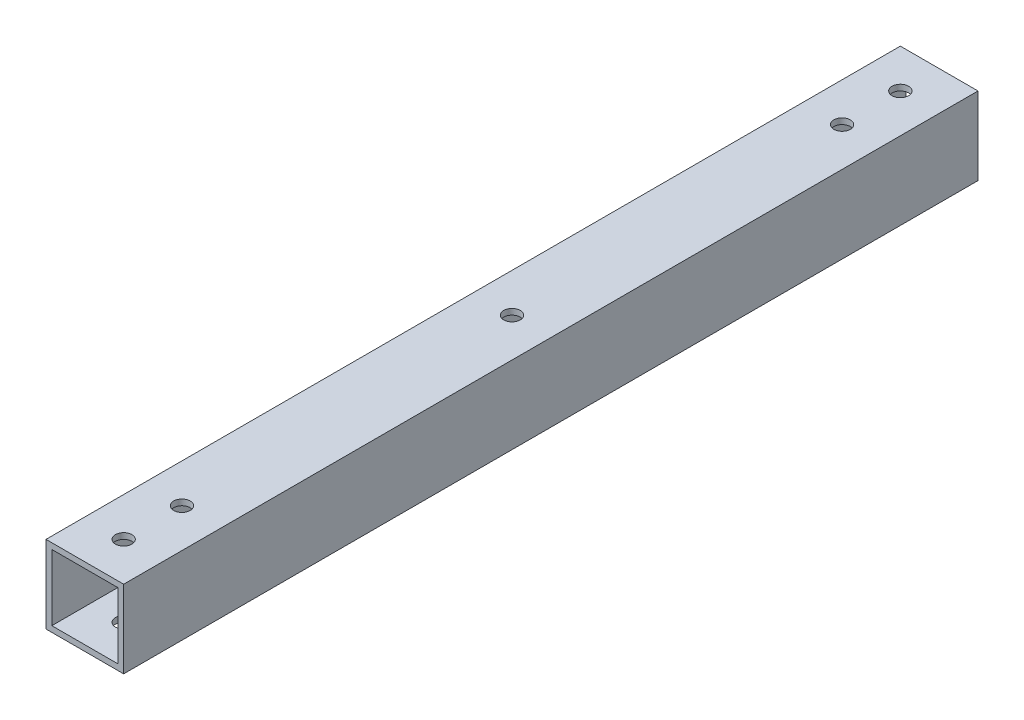
from build123d import *

# Parameters (mm, degrees)
SKETCH1_W           = 20
SKETCH1_H           = 20
SKETCH1_W_2         = 17
SKETCH1_H_2         = 17
BOSS_EXTRUDE1_DEPTH = 220
SKETCH2_R           = 2.125
CUT_EXTRUDE1_DEPTH  = 222.133443875


with BuildPart() as part:
    # Sketch1 → Boss-Extrude1 (new body)
    with BuildSketch(Plane.XY):
        Rectangle(SKETCH1_W, SKETCH1_H)
        Rectangle(SKETCH1_W_2, SKETCH1_H_2, mode=Mode.SUBTRACT)
    extrude(amount=-BOSS_EXTRUDE1_DEPTH)

    # Sketch2 → Cut-Extrude1 (cut, through all)
    with BuildSketch(Plane(origin=(0, 10, 0), x_dir=(1, 0, 0), z_dir=(0, 1, 0))):
        with Locations(Location((0, 10, 0), (0, 0, 270))):
            Circle(SKETCH2_R)
        with Locations(Location((0, 110, 0), (0, 0, 270))):
            Circle(SKETCH2_R)
        with Locations(Location((0, 210, 0), (0, 0, 270))):
            Circle(SKETCH2_R)
        with Locations(Location((0, 25, 0), (0, 0, 270))):
            Circle(SKETCH2_R)
        with Locations(Location((0, 195, 0), (0, 0, 90))):
            Circle(SKETCH2_R)
    extrude(amount=-CUT_EXTRUDE1_DEPTH, mode=Mode.SUBTRACT)


solid = part.part
